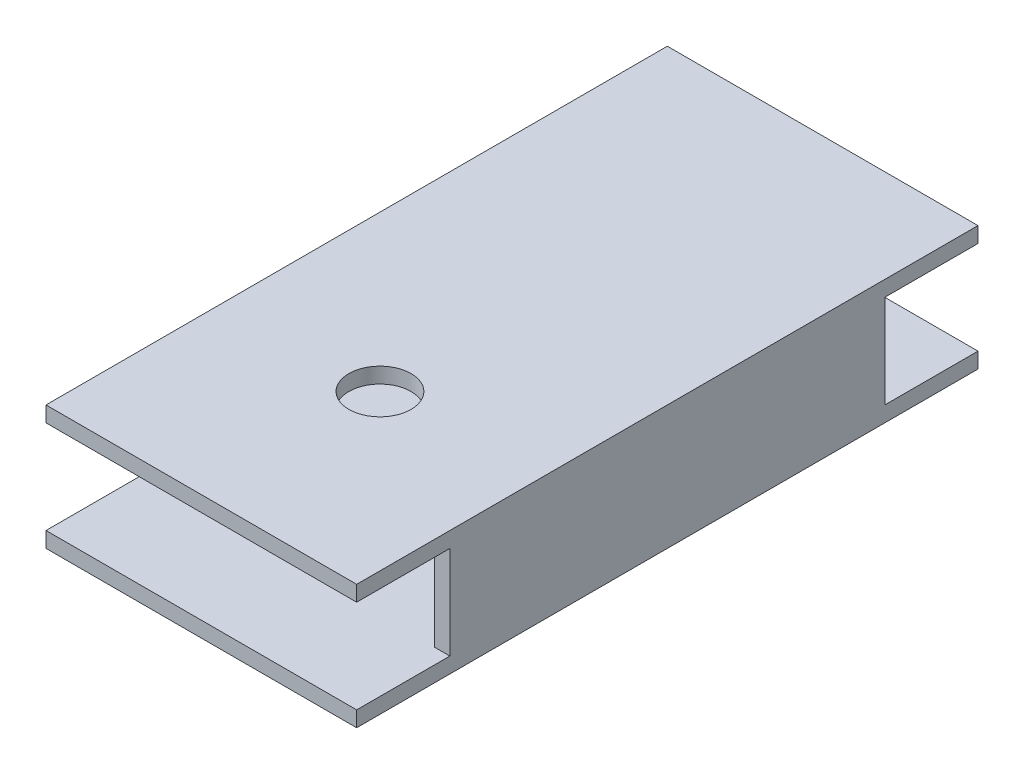
from build123d import *

# Parameters (mm, degrees)
SKETCH1_W           = 63.5
SKETCH1_H           = 25.4
SKETCH1_W_2         = 57.15
SKETCH1_H_2         = 19.05
EXTRUDE_THIN1_DEPTH = 127
SKETCH2_W           = 19.05
SKETCH2_H           = 19.05
CUT_EXTRUDE1_DEPTH  = 145.244271983
SKETCH3_W           = 19.05
SKETCH3_H           = 19.05
CUT_EXTRUDE2_DEPTH  = 145.244271983
SKETCH4_R           = 6.35
CUT_EXTRUDE3_DEPTH  = 145.244271983


with BuildPart() as part:
    # Sketch1 → Extrude-Thin1 (new body)
    with BuildSketch(Plane.XY):
        with Locations((31.75, 12.7)):
            Rectangle(SKETCH1_W, SKETCH1_H)
        with Locations((31.75, 12.7)):
            Rectangle(SKETCH1_W_2, SKETCH1_H_2, mode=Mode.SUBTRACT)
    extrude(amount=EXTRUDE_THIN1_DEPTH)

    # Sketch2 → Cut-Extrude1 (cut, through all)
    with BuildSketch(Plane(origin=(63.5, 0, 0), x_dir=(0, 0, -1), z_dir=(1, 0, 0))):
        with Locations((-9.525, 12.7)):
            Rectangle(SKETCH2_W, SKETCH2_H)
    extrude(amount=-CUT_EXTRUDE1_DEPTH, mode=Mode.SUBTRACT)

    # Sketch3 → Cut-Extrude2 (cut, through all)
    with BuildSketch(Plane(origin=(63.5, 0, 0), x_dir=(0, 0, -1), z_dir=(1, 0, 0))):
        with Locations((-117.475, 12.7)):
            Rectangle(SKETCH3_W, SKETCH3_H)
    extrude(amount=-CUT_EXTRUDE2_DEPTH, mode=Mode.SUBTRACT)

    # Sketch4 → Cut-Extrude3 (cut, through all)
    with BuildSketch(Plane(origin=(0, 25.4, 0), x_dir=(1, 0, 0), z_dir=(0, 1, 0))):
        with Locations(Location((31.75, -90.4875, 0), (0, 0, 270))):
            Circle(SKETCH4_R)
    extrude(amount=-CUT_EXTRUDE3_DEPTH, mode=Mode.SUBTRACT)


solid = part.part
